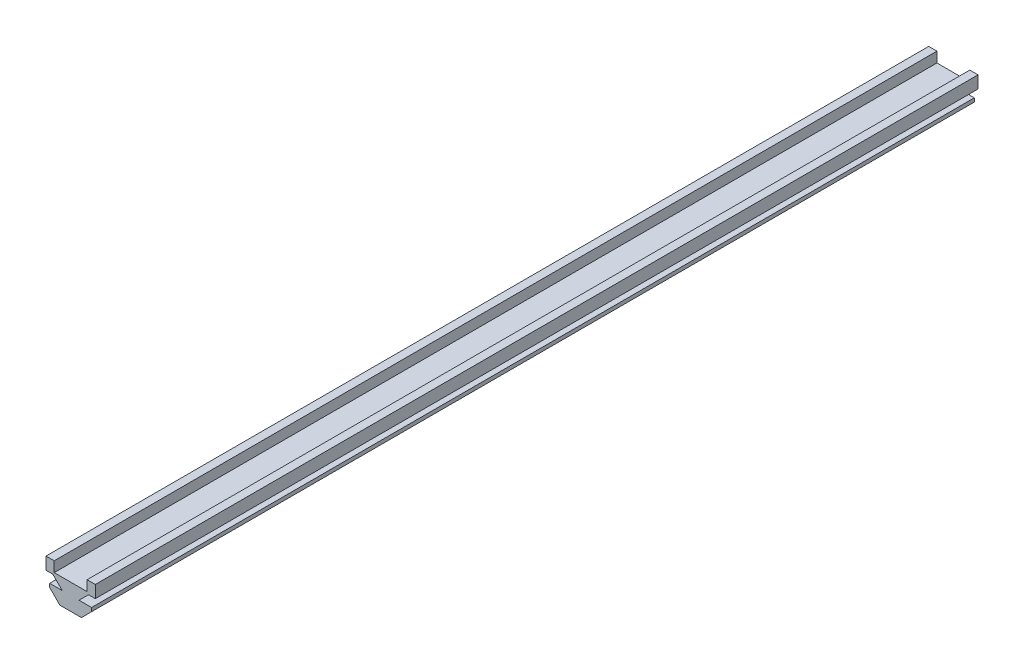
from build123d import *

# Parameters (mm, degrees)
SALIENTE_EXTRUIR1_DEPTH = 215


with BuildPart() as part:
    # Croquis1 → Saliente-Extruir1 (new body)
    with BuildSketch(Plane.XY):
        Polygon((7.372056275, -5.675), (10, -5.675), (10, 0.5), (6, 0.5), (6, 3), (4, 3), (4, 0), (4.4, 0), (4.95, 0), (5.657106781, 0), (7.957106781, -2.3), (4.9, -2.3), (4.9, -3.202943725), align=None)
        Polygon((10, -5.675), (12.627943725, -5.675), (15.1, -3.202943725), (15.1, -2.3), (12.042893219, -2.3), (14.342893219, 0), (16, 0), (16, 3), (14, 3), (14, 0.5), (10, 0.5), align=None)
    extrude(amount=SALIENTE_EXTRUIR1_DEPTH)


solid = part.part
